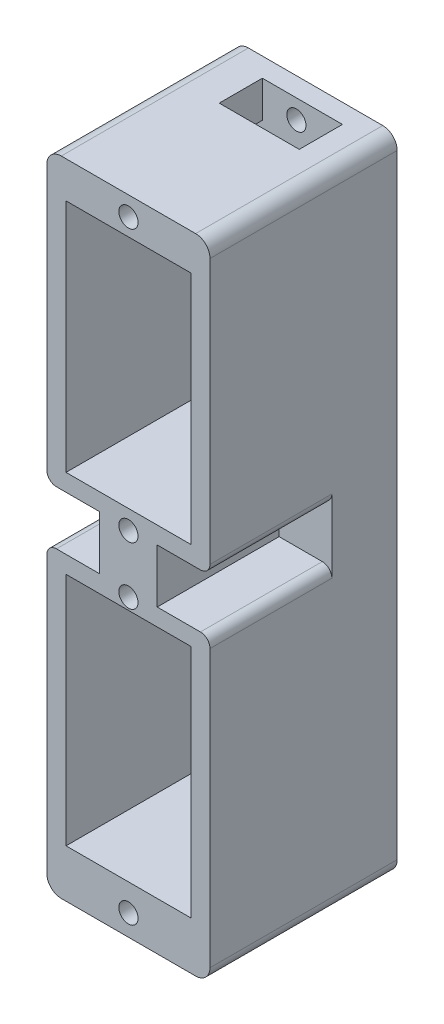
from build123d import *

# Parameters (mm, degrees)
SKETCH4_W           = 17
SKETCH4_H           = 67
BOSS_EXTRUDE1_DEPTH = 19.5
FILLET1_R           = 1.5
SKETCH5_W           = 13
SKETCH5_H           = 24.5
CUT_EXTRUDE1_DEPTH  = 17.5
SKETCH6_W           = 5.5
SKETCH6_H           = 5.6
CUT_EXTRUDE2_DEPTH  = 12.7
FILLET2_R           = 1
SKETCH7_R           = 1
CUT_EXTRUDE3_DEPTH  = 337.829426821
SKETCH8_W           = 9.5
SKETCH8_H           = 4.5
CUT_EXTRUDE4_DEPTH  = 5
SKETCH9_W           = 8.343526146
SKETCH9_H           = 4.5
CUT_EXTRUDE5_DEPTH  = 5


with BuildPart() as part:
    # Sketch4 → Boss-Extrude1 (new body)
    with BuildSketch(Plane.XY.offset(30)):
        with Locations((-184.236990356, 242.047210693)):
            Rectangle(SKETCH4_W, SKETCH4_H)
    extrude(amount=BOSS_EXTRUDE1_DEPTH)

    # Fillet1
    fillet1_edges = [part.edges().sort_by_distance(p)[0] for p in [
        (-192.736990356, 275.547210693, 39.75),
        (-175.736990356, 275.547210693, 39.75),
        (-175.736990356, 208.547210693, 39.75),
        (-192.736990356, 208.547210693, 39.75),
    ]]
    fillet(fillet1_edges, radius=FILLET1_R)

    # Sketch5 → Cut-Extrude1 (cut)
    with BuildSketch(Plane.XY.offset(49.5)):
        with Locations((-184.236990356, 259.497210693)):
            Rectangle(SKETCH5_W, SKETCH5_H)
        with Locations((-184.236990356, 225.797210693)):
            Rectangle(SKETCH5_W, SKETCH5_H)
    extrude(amount=-CUT_EXTRUDE1_DEPTH, mode=Mode.SUBTRACT)

    # Sketch6 → Cut-Extrude2 (cut)
    with BuildSketch(Plane.XY.offset(49.5)):
        with Locations((-189.986990356, 242.647210693)):
            Rectangle(SKETCH6_W, SKETCH6_H)
        with Locations((-178.486990356, 242.647210693)):
            Rectangle(SKETCH6_W, SKETCH6_H)
    extrude(amount=-CUT_EXTRUDE2_DEPTH, mode=Mode.SUBTRACT)

    # Fillet2
    fillet2_edges = [part.edges().sort_by_distance(p)[0] for p in [
        (-192.736990356, 239.847210693, 43.15),
        (-192.736990356, 245.447210693, 43.15),
        (-175.736990356, 245.447210693, 43.15),
        (-175.736990356, 239.847210693, 43.15),
    ]]
    fillet(fillet2_edges, radius=FILLET2_R)

    # Sketch7 → Cut-Extrude3 (cut, through all)
    with BuildSketch(Plane.XY.offset(49.5)):
        with Locations((-184.236990356, 273.547210693)):
            Circle(SKETCH7_R)
        with Locations((-184.236990356, 210.747210693)):
            Circle(SKETCH7_R)
        with Locations((-184.236990356, 245.247210693)):
            Circle(SKETCH7_R)
        with Locations((-184.236990356, 239.247210693)):
            Circle(SKETCH7_R)
    extrude(amount=-CUT_EXTRUDE3_DEPTH, mode=Mode.SUBTRACT)

    # Sketch8 → Cut-Extrude4 (cut)
    with BuildSketch(Plane(origin=(0, 208.547210693, 0), x_dir=(-1, 0, 0), z_dir=(0, -1, 0))):
        with Locations((184.186990356, -34.25)):
            Rectangle(SKETCH8_W, SKETCH8_H)
    extrude(amount=-CUT_EXTRUDE4_DEPTH, mode=Mode.SUBTRACT)

    # Sketch9 → Cut-Extrude5 (cut)
    with BuildSketch(Plane(origin=(0, 275.547210693, 0), x_dir=(1, 0, 0), z_dir=(0, 1, 0))):
        with Locations((-183.608753429, -34.25)):
            Rectangle(SKETCH9_W, SKETCH9_H)
    extrude(amount=-CUT_EXTRUDE5_DEPTH, mode=Mode.SUBTRACT)


solid = part.part
